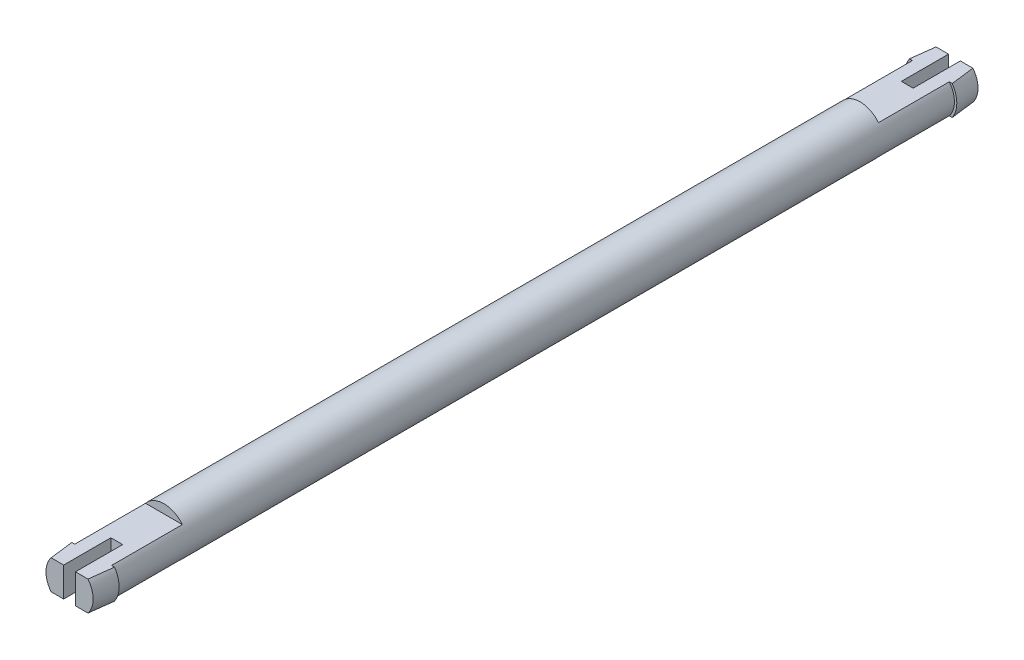
from build123d import *

# Parameters (mm, degrees)
SKETCH_1_R          = 2
EXTRUDE_1_DEPTH     = 75
SKETCH_3_W          = 4.2
SKETCH_3_H          = 1
CUT_EXTRUDE_1_DEPTH = 8
CUT_EXTRUDE_2_REACH = 77.103
SKETCH_4_W          = 1
SKETCH_4_H          = 4
SKETCH_6_W          = 4.2
SKETCH_6_H          = 1
CUT_EXTRUDE_3_DEPTH = 8
SKETCH_7_W          = 1
SKETCH_7_H          = 4
CUT_EXTRUDE_4_DEPTH = 76.102613137


with BuildPart() as part:
    # 草图1 → 凸台-拉伸1 (new body)
    with BuildSketch(Plane.XY):
        Circle(SKETCH_1_R)
    extrude(amount=-EXTRUDE_1_DEPTH)

    # 草图2 → 旋转1 (revolve)
    with BuildSketch(Plane(origin=(0, 0, 0), x_dir=(1, 0, 0), z_dir=(0, 1, 0))):
        Polygon((0, 0), (0, 2), (2.2, 2), (2, 0), align=None)
    revolve(axis=Axis((0, 0, 0), (0, 0, -1)))

    # 草图3 → 切除-拉伸1 (cut)
    with BuildSketch(Plane.XY):
        with Locations((0, 1.75)):
            Rectangle(SKETCH_3_W, SKETCH_3_H)
        with Locations((0, -1.75)):
            Rectangle(SKETCH_3_W, SKETCH_3_H)
    extrude(amount=-CUT_EXTRUDE_1_DEPTH, mode=Mode.SUBTRACT)

    # 草图4 → 切除-拉伸2 (cut, up to next)
    with BuildSketch(Plane.XZ.offset(1.25), mode=Mode.PRIVATE) as cut_extrude_2_sk1:
        with Locations((0, -2)):
            Rectangle(SKETCH_4_W, SKETCH_4_H)
    cut_extrude_2_tool1 = extrude(cut_extrude_2_sk1.sketch, amount=-CUT_EXTRUDE_2_REACH, mode=Mode.PRIVATE) & part.part
    add(cut_extrude_2_tool1.solids().sort_by_distance((0, -1.25, -2))[0], mode=Mode.SUBTRACT)

    # 草图5 → 旋转2 (revolve)
    with BuildSketch(Plane(origin=(0, 0, 0), x_dir=(1, 0, 0), z_dir=(0, 1, 0))):
        Polygon((0, 75), (0, 73), (2.2, 73), (2, 75), align=None)
    revolve(axis=Axis((0, 0, -58.137689197), (0, 0, -1)))

    # 草图6 → 切除-拉伸3 (cut)
    with BuildSketch(Plane(origin=(0, 0, -75), x_dir=(-1, 0, 0), z_dir=(0, 0, -1))):
        with Locations((0, 1.75)):
            Rectangle(SKETCH_6_W, SKETCH_6_H)
        with Locations((0, -1.75)):
            Rectangle(SKETCH_6_W, SKETCH_6_H)
    extrude(amount=-CUT_EXTRUDE_3_DEPTH, mode=Mode.SUBTRACT)

    # 草图7 → 切除-拉伸4 (cut, through all)
    with BuildSketch(Plane(origin=(0, 1.25, 0), x_dir=(1, 0, 0), z_dir=(0, 1, 0))):
        with Locations((0, 73)):
            Rectangle(SKETCH_7_W, SKETCH_7_H)
    extrude(amount=-CUT_EXTRUDE_4_DEPTH, mode=Mode.SUBTRACT)


solid = part.part
